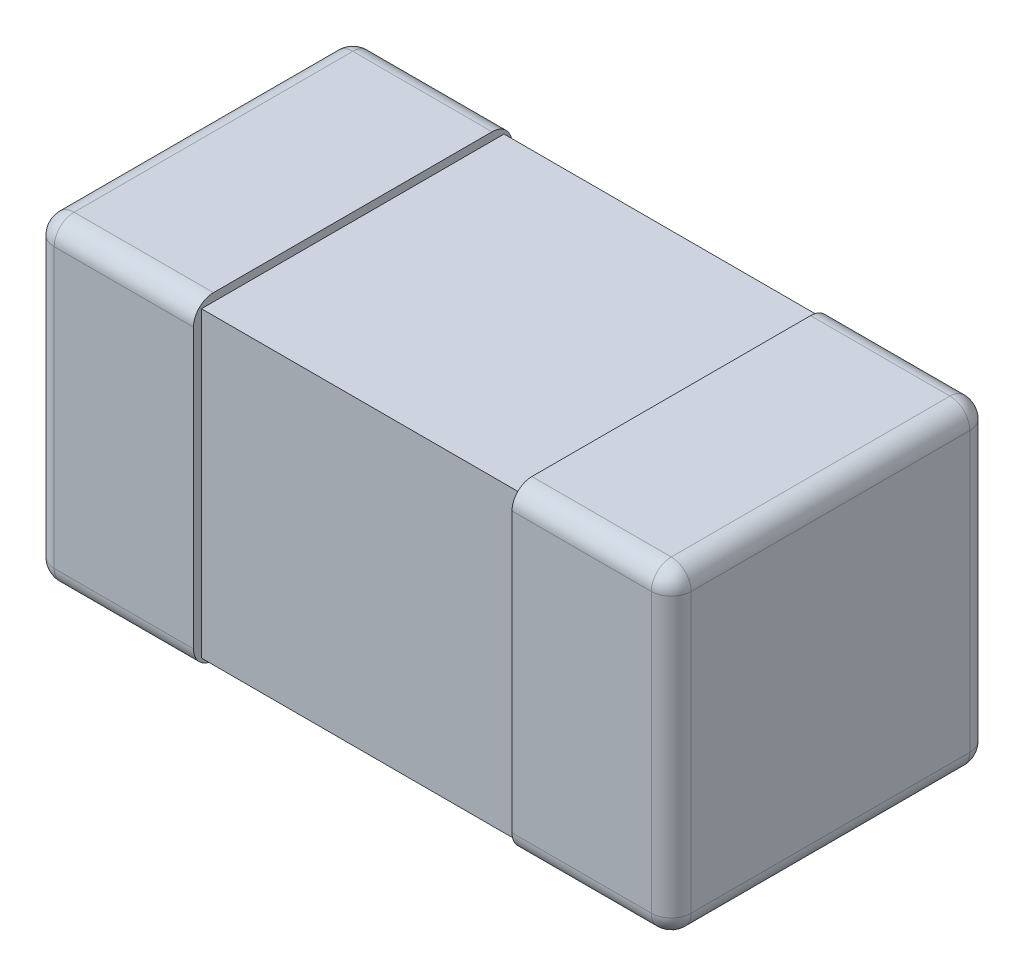
from build123d import *

# Parameters (mm, degrees)
SKETCH1_W               = 1.6
SKETCH1_H               = 0.8
BOSS_EXTRUDE1_DEPTH     = 0.8
CUT_EXTRUDE1_DEPTH      = 0.4
CUT_EXTRUDE1_DEPTH_BACK = 0.4
SKETCH2_OUTSIDE_W       = 3.192
SKETCH2_OUTSIDE_H       = 3.192
SKETCH2_OUTSIDE_W_2     = 0.76
SKETCH2_OUTSIDE_H_2     = 0.76
FILLET1_R               = 0.05


with BuildPart() as part:
    # Sketch1 → Boss-Extrude1 (new body)
    with BuildSketch(Plane(origin=(0, 0, 0), x_dir=(1, 0, 0), z_dir=(0, 1, 0))):
        Rectangle(SKETCH1_W, SKETCH1_H)
    extrude(amount=BOSS_EXTRUDE1_DEPTH)

    # Sketch2 outside → Cut-Extrude1 (cut, two sides: drawn at the far end of the back side and taken through both)
    with BuildSketch(Plane(origin=(0, 0, 0), x_dir=(0, 0, -1), z_dir=(1, 0, 0)).offset(-CUT_EXTRUDE1_DEPTH_BACK)):
        with Locations((0, 0.4)):
            Rectangle(SKETCH2_OUTSIDE_W, SKETCH2_OUTSIDE_H)
        with Locations((0, 0.4)):
            Rectangle(SKETCH2_OUTSIDE_W_2, SKETCH2_OUTSIDE_H_2, mode=Mode.SUBTRACT)
    extrude(amount=CUT_EXTRUDE1_DEPTH + CUT_EXTRUDE1_DEPTH_BACK, mode=Mode.SUBTRACT)

    # Fillet1
    fillet1_edges = [part.edges().sort_by_distance(p)[0] for p in [
        (0.8, 0.8, 0),
        (-0.6, 0, -0.4),
        (0.6, 0, 0.4),
        (0.6, 0.8, -0.4),
        (0.6, 0.8, 0.4),
        (-0.6, 0.8, -0.4),
        (-0.8, 0.8, 0),
        (0.6, 0, -0.4),
        (0.8, 0, 0),
        (-0.6, 0, 0.4),
        (-0.8, 0, 0),
        (-0.8, 0.4, -0.4),
        (0.8, 0.4, -0.4),
        (0.8, 0.4, 0.4),
        (-0.8, 0.4, 0.4),
        (-0.6, 0.8, 0.4),
    ]]
    fillet(fillet1_edges, radius=FILLET1_R)


solid = part.part
